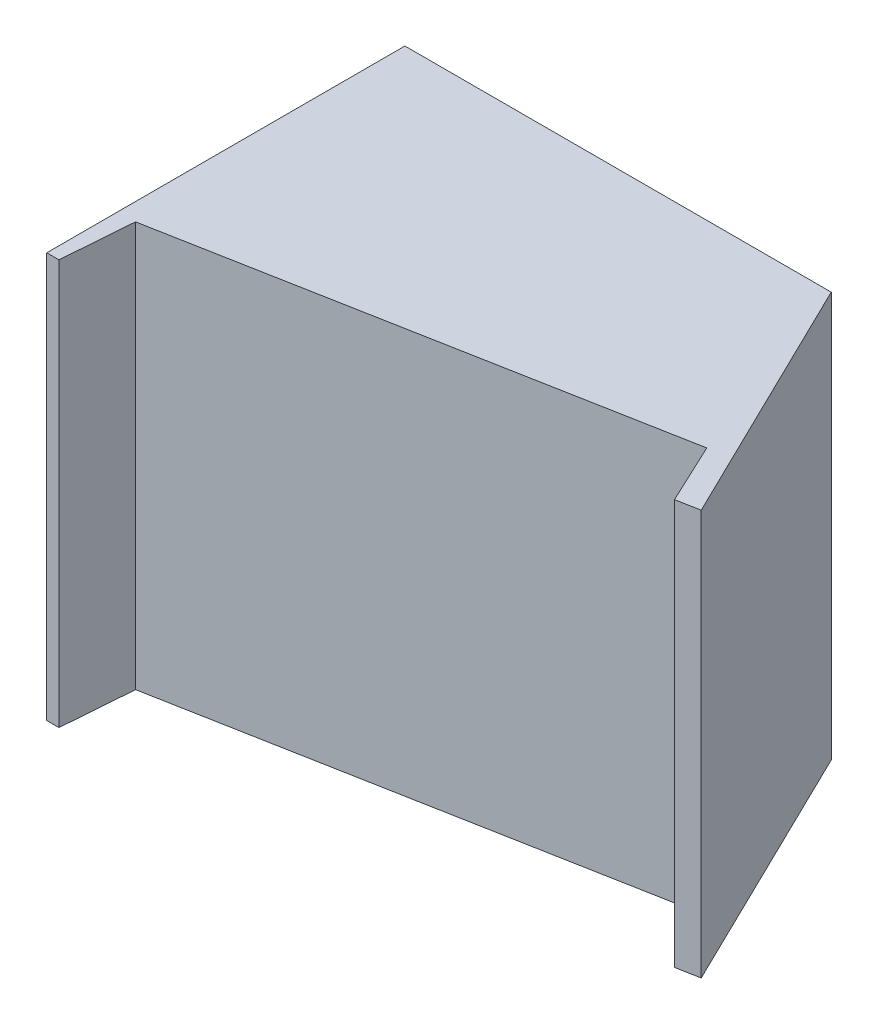
from build123d import *

# Parameters (mm, degrees)
SKETCH1_W               = 449.978341512
SKETCH1_H               = 427.573746213
BOSS_EXTRUDE1_DEPTH     = 378
DRAFT2_ANGLE            = 26
CUT_EXTRUDE1_DEPTH      = 854.283154982
CUT_EXTRUDE1_DEPTH_BACK = 854.283154982


with BuildPart() as part:
    # Sketch1 → Boss-Extrude1 (new body)
    with BuildSketch(Plane.XY):
        with Locations((224.989170756, 213.786873107)):
            Rectangle(SKETCH1_W, SKETCH1_H)
    extrude(amount=BOSS_EXTRUDE1_DEPTH)

    # Draft2
    draft2_faces = [part.faces().sort_by_distance(p)[0] for p in [
        (449.978341512, 213.786873106, 189),
    ]]
    draft(draft2_faces, Plane(origin=(0, 0, 0), x_dir=(-1, 0, 0), z_dir=(0, 0, -1)), DRAFT2_ANGLE)

    # Sketch2 → Cut-Extrude1 (cut, two sides: drawn at the far end of the back side and taken through both)
    with BuildSketch(Plane(origin=(0, 427.573746213, 0), x_dir=(1, 0, 0), z_dir=(0, 1, 0)).offset(-CUT_EXTRUDE1_DEPTH_BACK)):
        Polygon((-98.889763821, -1838.554406759), (12.856362316, -378), (18.603916927, -302.877787654), (526.667256984, -208.060368048), (556.854417648, -272.355099853), (580.648945558, -267.914441457), (2020.610369742, 0.818639262), (3940.798807951, -2211.804656514), (1821.298674388, -4051.177702535), align=None)
    extrude(amount=CUT_EXTRUDE1_DEPTH + CUT_EXTRUDE1_DEPTH_BACK, mode=Mode.SUBTRACT)


solid = part.part
